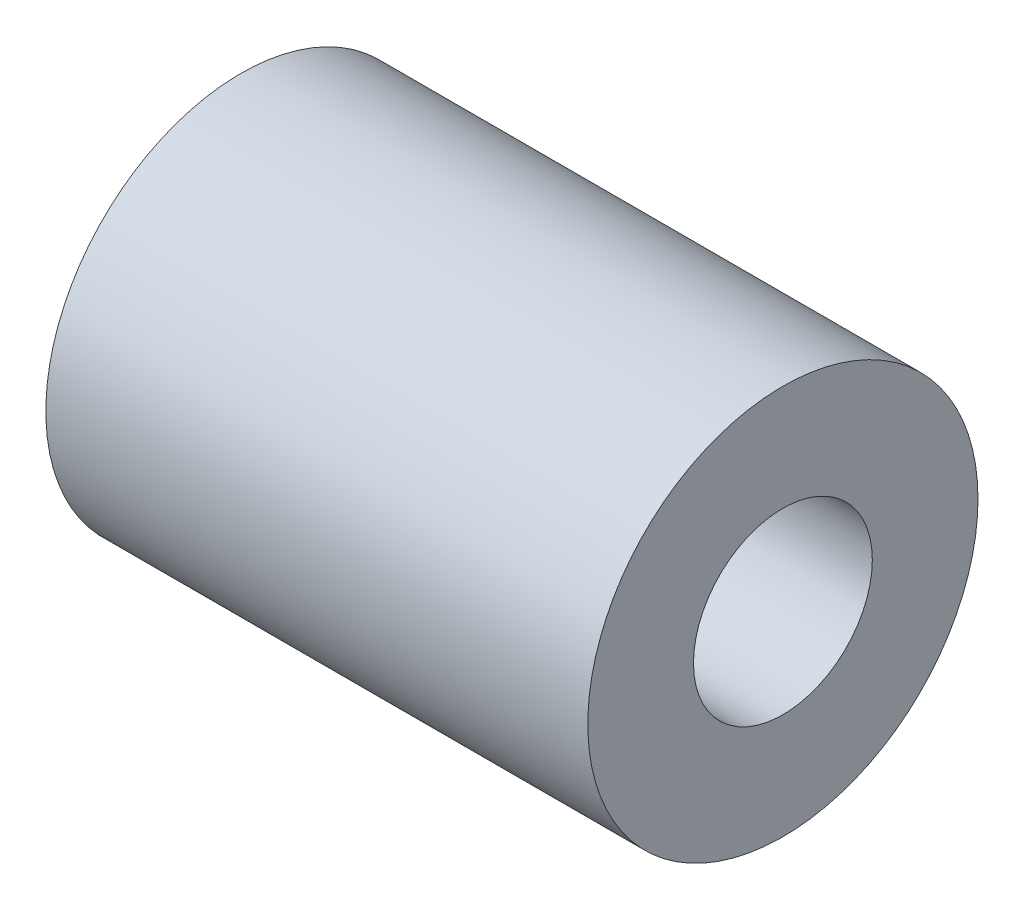
from build123d import *

# Parameters (mm, degrees)
SKETCH_1_R      = 3.6
SKETCH_1_R_2    = 1.65
EXTRUDE_1_DEPTH = 10


with BuildPart() as part:
    # 草图1 → 凸台-拉伸1 (new body)
    with BuildSketch(Plane(origin=(0, 0, 0), x_dir=(0, 0, -1), z_dir=(1, 0, 0))):
        Circle(SKETCH_1_R)
        Circle(SKETCH_1_R_2, mode=Mode.SUBTRACT)
    extrude(amount=EXTRUDE_1_DEPTH)


solid = part.part
